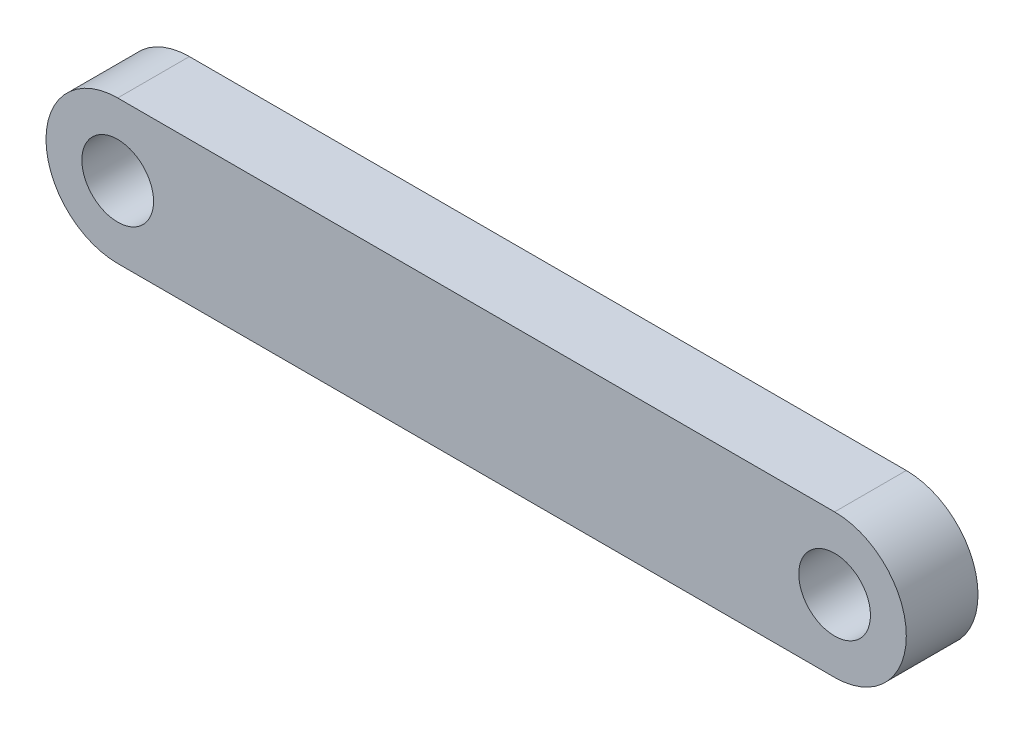
from build123d import *

# Parameters (mm, degrees)
SKETCH1_R           = 5
BOSS_EXTRUDE3_DEPTH = 10


with BuildPart() as part:
    # Sketch1 → Boss-Extrude3 (new body)
    with BuildSketch(Plane.XY):
        with BuildLine():
            Line((-50, 10), (50, 10))
            ThreePointArc((50, 10), (60, 0), (50, -10))
            Line((50, -10), (-50, -10))
            ThreePointArc((-50, -10), (-60, 0), (-50, 10))
        make_face()
        with Locations((-50, 0)):
            Circle(SKETCH1_R, mode=Mode.SUBTRACT)
        with Locations((50, 0)):
            Circle(SKETCH1_R, mode=Mode.SUBTRACT)
    extrude(amount=BOSS_EXTRUDE3_DEPTH)


solid = part.part
